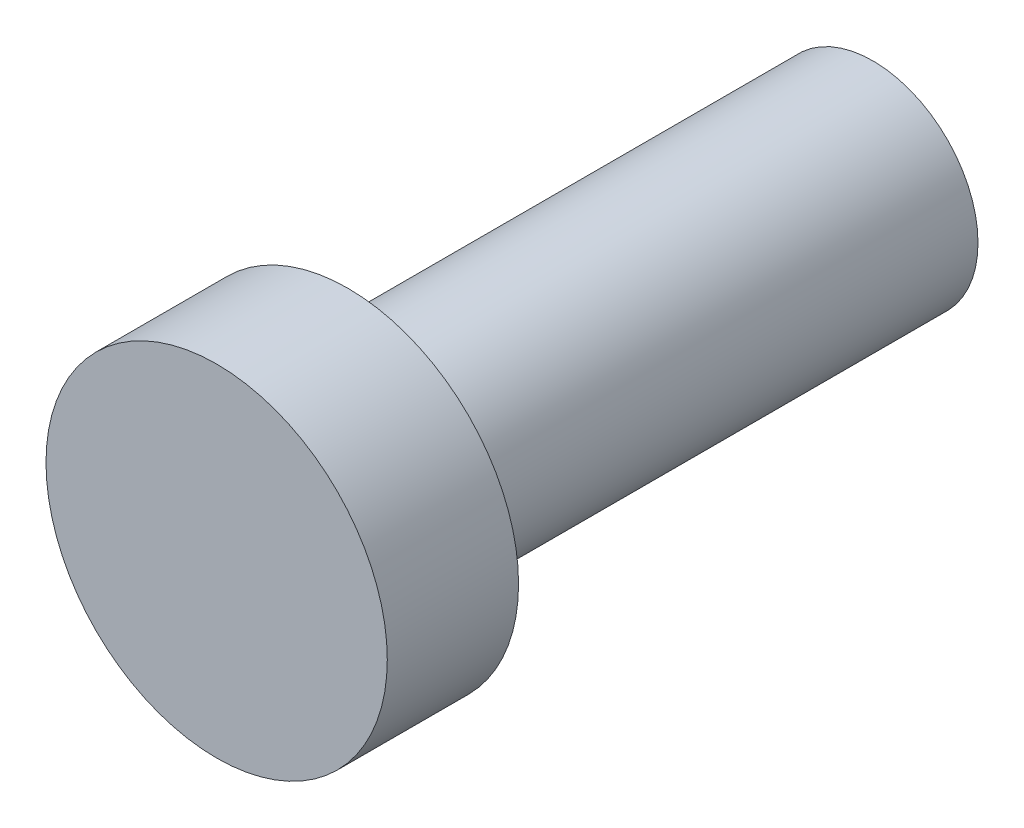
from build123d import *

# Parameters (mm, degrees)
ESQUISSE1_R        = 4
BOSS_EXTRU_1_DEPTH = 20
ESQUISSE2_R        = 6.5
BOSS_EXTRU_2_DEPTH = 5


with BuildPart() as part:
    # Esquisse1 → Boss.-Extru.1 (new body)
    with BuildSketch(Plane.XY):
        Circle(ESQUISSE1_R)
    extrude(amount=BOSS_EXTRU_1_DEPTH)

    # Esquisse2 → Boss.-Extru.2 (add)
    with BuildSketch(Plane.XY.offset(20)):
        Circle(ESQUISSE2_R)
    extrude(amount=BOSS_EXTRU_2_DEPTH)


solid = part.part
